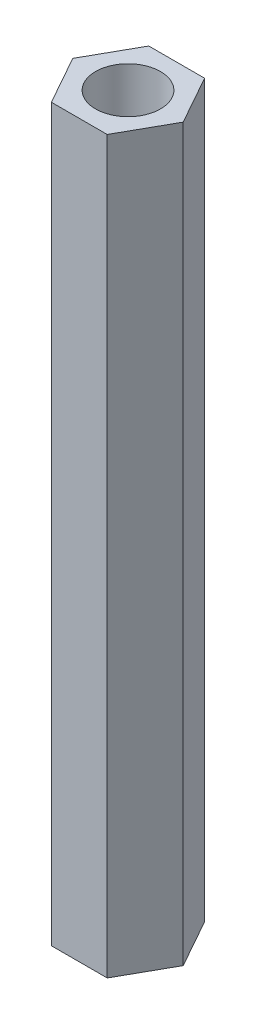
from build123d import *

# Parameters (mm, degrees)
SKETCH_1_R      = 2
EXTRUDE_1_DEPTH = 45


with BuildPart() as part:
    # 草图1 → 凸台-拉伸1 (new body)
    with BuildSketch(Plane(origin=(0, 0, 0), x_dir=(1, 0, 0), z_dir=(0, 1, 0))):
        Polygon((1.719345719, -3), (3.4, 0), (1.719345719, 3), (-1.719345719, 3), (-3.4, 0), (-1.719345719, -3), align=None)
        with Locations(Location((0, 0, 0), (0, 0, 90))):
            Circle(SKETCH_1_R, mode=Mode.SUBTRACT)
    extrude(amount=EXTRUDE_1_DEPTH)


solid = part.part
